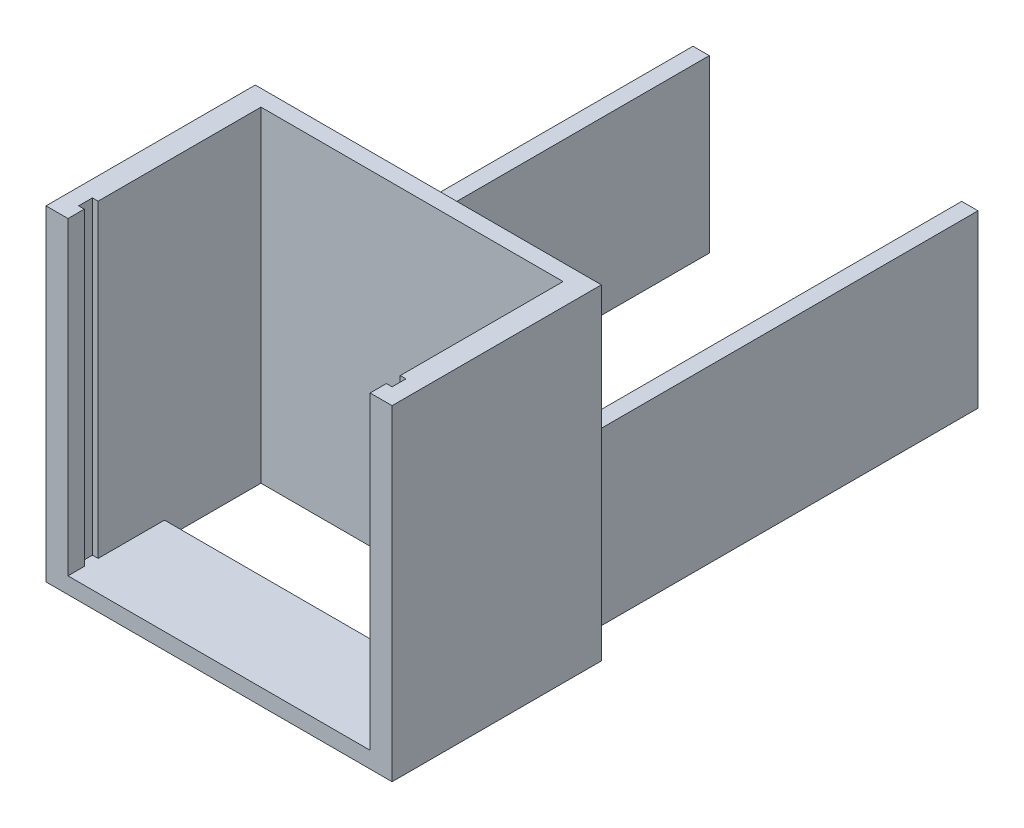
from build123d import *

# Parameters (mm, degrees)
BOSS_EXTRUDE1_DEPTH   = 38
BOSS_EXTRUDE1_2_DEPTH = 38
SKETCH2_W             = 42.5
SKETCH2_H             = 5.7
BOSS_EXTRUDE2_DEPTH   = 2
BOSS_EXTRUDE3_DEPTH   = 18
SKETCH4_W             = 42.5
SKETCH4_H             = 40
BOSS_EXTRUDE4_DEPTH   = 2
SKETCH5_W             = 37.1
SKETCH5_H             = 11.85
CUT_EXTRUDE1_DEPTH    = 81.281509747
SKETCH6_W             = 2
SKETCH6_H             = 21
BOSS_EXTRUDE6_DEPTH   = 50


with BuildPart() as part:
    # Sketch1 → Boss-Extrude1 (new body)
    with BuildSketch(Plane(origin=(0, 0, 0), x_dir=(1, 0, 0), z_dir=(0, 1, 0))):
        Polygon((-62.898983402, -26.09346473), (-62.898983402, -24.39346473), (-62.198983402, -24.39346473), (-62.198983402, -22.39346473), (-64.898983402, -22.39346473), (-64.898983402, -28.09346473), (-62.198983402, -28.09346473), (-62.198983402, -26.09346473), align=None)
    extrude(amount=BOSS_EXTRUDE1_DEPTH)



with BuildPart() as body_2:
    # Sketch1 → Boss-Extrude1 2 (new body)
    with BuildSketch(Plane(origin=(0, 0, 0), x_dir=(1, 0, 0), z_dir=(0, 1, 0))):
        Polygon((-25.098983402, -22.39346473), (-25.098983402, -24.39346473), (-24.398983402, -24.39346473), (-24.398983402, -26.09346473), (-25.098983402, -26.09346473), (-25.098983402, -28.09346473), (-22.398983402, -28.09346473), (-22.398983402, -22.39346473), align=None)
    extrude(amount=BOSS_EXTRUDE1_2_DEPTH)


with BuildPart() as part_1:
    add(part.part)

    add(body_2.part)  # Boss-Extrude2 merges body 2
    # Sketch2 → Boss-Extrude2 (add)
    with BuildSketch(Plane(origin=(0, 0, 0), x_dir=(1, 0, 0), z_dir=(0, 1, 0))):
        with Locations((-43.648983402, -25.24346473)):
            Rectangle(SKETCH2_W, SKETCH2_H)
    extrude(amount=-BOSS_EXTRUDE2_DEPTH)

    # Sketch3 → Boss-Extrude3 (add)
    with BuildSketch(Plane(origin=(0, 0, 22.39346473), x_dir=(-1, 0, 0), z_dir=(0, 0, -1))):
        Polygon((64.898983402, 38), (62.198983402, 38), (62.198983402, 0), (25.098983402, 0), (25.098983402, 38), (22.398983402, 38), (22.398983402, -2), (64.898983402, -2), align=None)
    extrude(amount=BOSS_EXTRUDE3_DEPTH)

    # Sketch4 → Boss-Extrude4 (add)
    with BuildSketch(Plane(origin=(0, 0, 4.39346473), x_dir=(-1, 0, 0), z_dir=(0, 0, -1))):
        with Locations((43.648983402, 18)):
            Rectangle(SKETCH4_W, SKETCH4_H)
    extrude(amount=BOSS_EXTRUDE4_DEPTH)

    # Sketch5 → Cut-Extrude1 (cut, through all)
    with BuildSketch(Plane(origin=(0, 0, 0), x_dir=(1, 0, 0), z_dir=(0, 1, 0))):
        with Locations((-43.648983402, -10.31846473)):
            Rectangle(SKETCH5_W, SKETCH5_H)
    extrude(amount=-CUT_EXTRUDE1_DEPTH, mode=Mode.SUBTRACT)

    # Sketch6 → Boss-Extrude6 (add)
    with BuildSketch(Plane(origin=(0, 0, 2.39346473), x_dir=(-1, 0, 0), z_dir=(0, 0, -1))):
        with Locations((27.148983402, 8.5)):
            Rectangle(SKETCH6_W, SKETCH6_H)
        with Locations((60.148983402, 8.5)):
            Rectangle(SKETCH6_W, SKETCH6_H)
    extrude(amount=BOSS_EXTRUDE6_DEPTH)


solid = part_1.part
